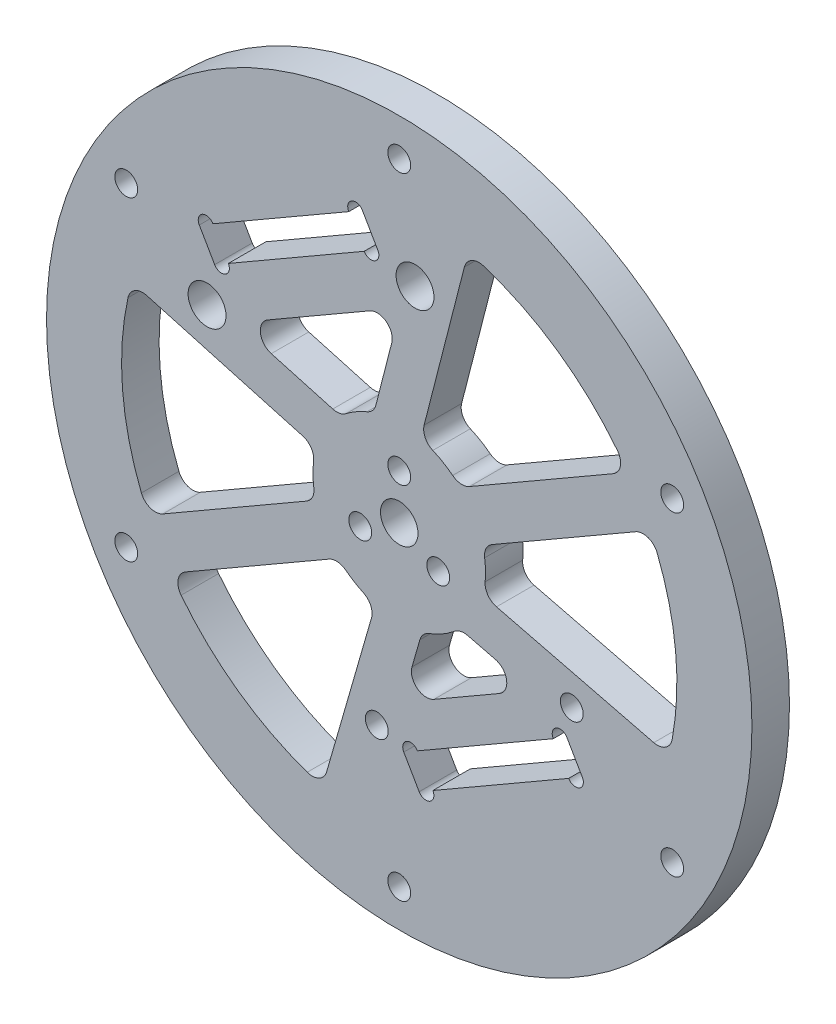
from build123d import *

# Parameters (mm, degrees)
SKETCH_1_R                   = 47
EXTRUDE_1_DEPTH              = 5
SKETCH_2_R                   = 1.525
CUT_EXTRUDE_1_DEPTH          = 25
CUT_EXTRUDE_3_DEPTH          = 10
SKETCH_5_R                   = 1.05
CUT_EXTRUDE_4_DEPTH          = 40
CUT_EXTRUDE_7_DEPTH          = 10
SKETCH_8_R                   = 1.05
CUT_EXTRUDE_8_DEPTH          = 10
SKETCH_11_R                  = 1.525
CUT_EXTRUDE_9_DEPTH          = 10
SKETCH_12_R                  = 1.525
SKETCH_12_R_2                = 2.525
CUT_EXTRUDE_10_DEPTH         = 6.5
SKETCH_13_R                  = 2.5
CUT_EXTRUDE_11_DEPTH         = 50
CUT_EXTRUDE_13_DEPTH         = 50
HOLE_WIZARD_M3_1_D           = 3
HOLE_WIZARD_M3_1_CSINK_D     = 6.6
HOLE_WIZARD_M3_1_CSINK_ANGLE = 90
CUT_EXTRUDE_START            = -50
CUT_EXTRUDE_14_DEPTH         = 50
CUT_EXTRUDE_15_DEPTH         = 50
FILLET_1_R                   = 2


with BuildPart() as part:
    # 草图1 → 凸台-拉伸1 (new body)
    with BuildSketch(Plane.XY):
        Circle(SKETCH_1_R)
    extrude(amount=EXTRUDE_1_DEPTH)

    # 草图2 → 切除-拉伸1 (cut)
    with BuildSketch(Plane.XY.offset(5)):
        with Locations((0, 42)):
            Circle(SKETCH_2_R)
        with Locations((36.373066959, 21)):
            Circle(SKETCH_2_R)
        with Locations((36.373066959, -21)):
            Circle(SKETCH_2_R)
        with Locations((0, -42)):
            Circle(SKETCH_2_R)
        with Locations((-36.373066959, -21)):
            Circle(SKETCH_2_R)
        with Locations((-36.373066959, 21)):
            Circle(SKETCH_2_R)
    extrude(amount=-CUT_EXTRUDE_1_DEPTH, mode=Mode.SUBTRACT)

    # 草图4 → 切除-拉伸3 (cut)
    with BuildSketch(Plane.XY.offset(5)):
        Polygon((22.343618817, -13.600283017), (0.606381183, -26.150283017), (2.656381183, -29.700987172), (24.393618817, -17.150987172), align=None)
    extrude(amount=-CUT_EXTRUDE_3_DEPTH, mode=Mode.SUBTRACT)

    # 草图5 → 切除-拉伸4 (cut)
    with BuildSketch(Plane.XY.offset(5)):
        with Locations((21.434292144, -14.125283017)):
            Circle(SKETCH_5_R)
        with Locations((23.484292144, -17.675987172)):
            Circle(SKETCH_5_R)
        with Locations((1.515707856, -25.625283017)):
            Circle(SKETCH_5_R)
        with Locations((3.565707856, -29.175987172)):
            Circle(SKETCH_5_R)
    extrude(amount=-CUT_EXTRUDE_4_DEPTH, mode=Mode.SUBTRACT)

    # 草图7 → 切除-拉伸7 (cut)
    with BuildSketch(Plane.XY.offset(5)):
        Polygon((-4.906381183, 33.598101489), (-26.643618817, 21.048101489), (-24.593618817, 17.497397334), (-2.856381183, 30.047397334), align=None)
    extrude(amount=-CUT_EXTRUDE_7_DEPTH, mode=Mode.SUBTRACT)

    # 草图8 → 切除-拉伸8 (cut)
    with BuildSketch(Plane.XY.offset(5)):
        with Locations((-23.684292144, 18.022397334)):
            Circle(SKETCH_8_R)
        with Locations((-25.734292144, 21.573101489)):
            Circle(SKETCH_8_R)
        with Locations((-5.815707856, 33.073101489)):
            Circle(SKETCH_8_R)
        with Locations((-3.765707856, 29.522397334)):
            Circle(SKETCH_8_R)
    extrude(amount=-CUT_EXTRUDE_8_DEPTH, mode=Mode.SUBTRACT)

    # 草图11 → 切除-拉伸9 (cut)
    with BuildSketch(Plane.XY.offset(5)):
        with Locations((0, 6)):
            Circle(SKETCH_11_R)
        with Locations((5.196152423, -3)):
            Circle(SKETCH_11_R)
        with Locations((-5.196152423, -3)):
            Circle(SKETCH_11_R)
    extrude(amount=-CUT_EXTRUDE_9_DEPTH, mode=Mode.SUBTRACT)

    # 草图12 → 切除-拉伸10 (cut)
    with BuildSketch(Plane(origin=(0, 0, 0), x_dir=(-1, 0, 0), z_dir=(0, 0, -1))):
        with Locations((2.990381057, -24.820508076)):
            Circle(SKETCH_12_R)
        with Locations((-22.990381057, -9.820508076)):
            Circle(SKETCH_12_R)
        with Locations((-2.106406461, 28.351596989)):
            Circle(SKETCH_12_R_2)
        with Locations((25.606406461, 12.351596989)):
            Circle(SKETCH_12_R_2)
    extrude(amount=-CUT_EXTRUDE_10_DEPTH, mode=Mode.SUBTRACT)

    # 草图13 → 切除-拉伸11 (cut)
    with BuildSketch(Plane(origin=(0, 0, 0), x_dir=(-1, 0, 0), z_dir=(0, 0, -1))):
        Circle(SKETCH_13_R)
    extrude(amount=-CUT_EXTRUDE_11_DEPTH, mode=Mode.SUBTRACT)

    # 草图16 → 切除-拉伸13 (cut)
    with BuildSketch(Plane.XY.offset(5)):
        with BuildLine():
            Line((33.437438845, 15.841012703), (11.114442262, 2.952824616))
            ThreePointArc((11.114442262, 2.952824616), (11.40320319, 1.488944927), (11.5, 0))
            ThreePointArc((11.5, 0), (11.415217398, -1.393847822), (11.162119696, -2.767143635))
            Line((11.162119696, -2.767143635), (35.912906847, -8.90298387))
            ThreePointArc((35.912906847, -8.90298387), (36.727221195, -4.484553861), (37, 0))
            ThreePointArc((37, 0), (36.098374183, 8.11833612), (33.437438845, 15.841012703))
        make_face()
        with BuildLine():
            Line((9.18804638, 35.841035193), (2.855744145, 11.139781209))
            ThreePointArc((2.855744145, 11.139781209), (5.685285819, 9.996375601), (8.114442262, 8.148977039))
            Line((8.114442262, 8.148977039), (30.437438845, 21.037165126))
            ThreePointArc((30.437438845, 21.037165126), (21.150257967, 30.358962234), (9.18804638, 35.841035193))
        make_face()
        with BuildLine():
            ThreePointArc((-11.114442262, -2.952824616), (-11.499758126, 0.074585853), (-11.075205592, 3.096743628))
            Line((-11.075205592, 3.096743628), (-35.633270165, 9.96343602))
            ThreePointArc((-35.633270165, 9.96343602), (-36.866761511, -3.137179579), (-33.437438845, -15.841012703))
            Line((-33.437438845, -15.841012703), (-11.114442262, -2.952824616))
        make_face()
        with BuildLine():
            Line((-10.246243223, -35.552981588), (-3.184643164, -11.050251034))
            ThreePointArc((-3.184643164, -11.050251034), (-5.832810691, -9.911020101), (-8.114442262, -8.148977039))
            Line((-8.114442262, -8.148977039), (-30.437438845, -21.037165126))
            ThreePointArc((-30.437438845, -21.037165126), (-21.597863981, -30.042174879), (-10.246243223, -35.552981588))
        make_face()
    extrude(amount=-CUT_EXTRUDE_13_DEPTH, mode=Mode.SUBTRACT)

    # M3 十字槽沉头木螺钉的锥形沉头孔1 (through all)
    with Locations(Plane(origin=(0, 0, 0), x_dir=(-1, 0, 0), z_dir=(0, 0, -1))):
        with Locations((5.196152423, -3), (-5.196152423, -3), (0, 6)):
            CounterSinkHole(HOLE_WIZARD_M3_1_D / 2, HOLE_WIZARD_M3_1_CSINK_D / 2, counter_sink_angle=HOLE_WIZARD_M3_1_CSINK_ANGLE)

    # 草图19 → 切除-拉伸14 (cut)
    with BuildSketch(Plane(origin=(0, 0, 0), x_dir=(-1, 0, 0), z_dir=(0, 0, -1)).offset(CUT_EXTRUDE_START)):
        with BuildLine():
            Line((21.632488727, 12.278803359), (-0.182488727, 24.873686464))
            Line((-0.182488727, 24.873686464), (3.37580992, 10.993357421))
            ThreePointArc((3.37580992, 10.993357421), (5.75, 9.959292144), (7.832621839, 8.420215859))
            Line((7.832621839, 8.420215859), (21.632488727, 12.278803359))
        make_face()
    extrude(amount=CUT_EXTRUDE_14_DEPTH, mode=Mode.SUBTRACT)

    # 草图20 → 切除-拉伸15 (cut)
    with BuildSketch(Plane(origin=(0, 0, 0), x_dir=(-1, 0, 0), z_dir=(0, 0, -1)).offset(CUT_EXTRUDE_START)):
        with BuildLine():
            Line((-0.324840576, -20.53932787), (-3.0485131, -11.088578262))
            ThreePointArc((-3.0485131, -11.088578262), (-5.75, -9.959292144), (-8.078733917, -8.18437892))
            Line((-8.078733917, -8.18437892), (-17.625159424, -10.550984126))
            Line((-17.625159424, -10.550984126), (-0.324840576, -20.53932787))
        make_face()
    extrude(amount=CUT_EXTRUDE_15_DEPTH, mode=Mode.SUBTRACT)

    # 圆角1
    fillet_1_edges = [part.edges().sort_by_distance(p)[0] for p in [
        (8.114442262, 8.148977039, 2.5),
        (2.855744145, 11.139781209, 2.5),
        (9.18804638, 35.841035193, 2.5),
        (30.437438845, 21.037165126, 2.5),
        (-11.075205592, 3.096743628, 2.5),
        (-11.114442262, -2.952824616, 2.5),
        (-33.437438845, -15.841012703, 2.5),
        (-35.633270165, 9.96343602, 2.5),
        (-8.114442262, -8.148977039, 2.5),
        (-3.184643164, -11.050251034, 2.5),
        (-10.246243223, -35.552981588, 2.5),
        (-30.437438845, -21.037165126, 2.5),
        (11.162119696, -2.767143635, 2.5),
        (11.114442262, 2.952824616, 2.5),
        (33.437438845, 15.841012703, 2.5),
        (35.912906847, -8.90298387, 2.5),
        (-7.832621839, 8.420215859, 2.5),
        (-3.37580992, 10.993357421, 2.5),
        (0.182488727, 24.873686464, 2.5),
        (-21.632488727, 12.278803359, 2.5),
        (8.078733917, -8.18437892, 2.5),
        (3.0485131, -11.088578262, 2.5),
        (0.324840576, -20.53932787, 2.5),
        (17.625159424, -10.550984126, 2.5),
    ]]
    fillet(fillet_1_edges, radius=FILLET_1_R)


solid = part.part
